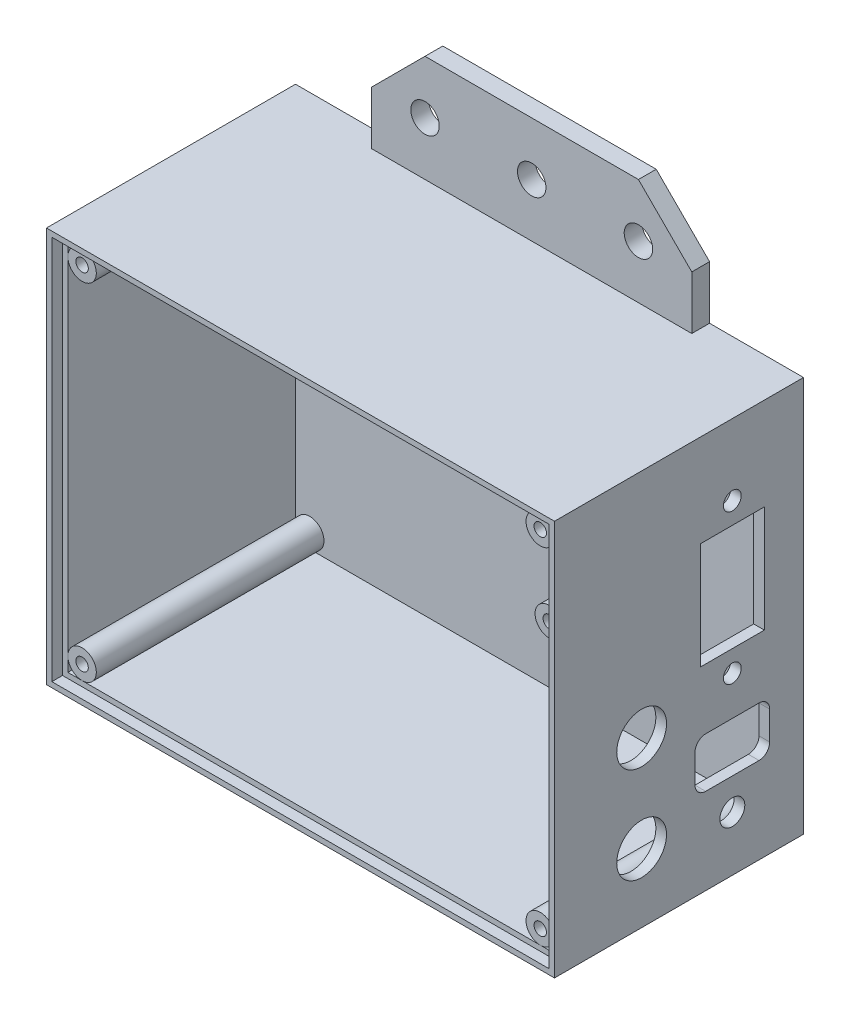
from build123d import *

# Parameters (mm, degrees)
CROQUIS2_W                = 142.8
CROQUIS2_H                = 111.2
CROQUIS2_R                = 1.75
SALIENTE_EXTRUIR1_DEPTH   = 3
CROQUIS3_R                = 4
CROQUIS3_R_2              = 1.75
SALIENTE_EXTRUIR7_DEPTH   = 70
SALIENTE_EXTRUIR7_2_DEPTH = 70
SALIENTE_EXTRUIR7_3_DEPTH = 70
SALIENTE_EXTRUIR7_4_DEPTH = 70
CROQUIS3_W                = 142.8
CROQUIS3_H                = 111.2
CROQUIS3_W_2              = 136.8
CROQUIS3_H_2              = 105.2
SALIENTE_EXTRUIR7_5_DEPTH = 70
CROQUIS4_R                = 4
CROQUIS4_R_2              = 1.75
SALIENTE_EXTRUIR8_DEPTH   = 10
CROQUIS5_R                = 4
CORTAR_EXTRUIR1_DEPTH     = 1.5
CROQUIS6_R                = 2.5
CROQUIS6_R_2              = 7
CROQUIS6_R_3              = 3.5
CROQUIS6_W                = 18
CROQUIS6_H                = 30
CORTAR_EXTRUIR2_DEPTH     = 37.5
CORTAR_EXTRUIR3_DEPTH     = 3
CROQUIS8_R                = 4
SALIENTE_EXTRUIR9_DEPTH   = 5


with BuildPart() as part:
    # Croquis2 → Saliente-Extruir1 (new body)
    with BuildSketch(Plane.XY):
        with Locations((-26.4, -20.6)):
            Rectangle(CROQUIS2_W, CROQUIS2_H)
        Circle(CROQUIS2_R, mode=Mode.SUBTRACT)
        with Locations((-50.8, -11.75)):
            Circle(CROQUIS2_R, mode=Mode.SUBTRACT)
        with Locations((-16.46, -50.2)):
            Circle(CROQUIS2_R, mode=Mode.SUBTRACT)
    extrude(amount=SALIENTE_EXTRUIR1_DEPTH)



with BuildPart() as body_2:
    # Croquis3 → Saliente-Extruir7 (new body)
    with BuildSketch(Plane.XY):
        with Locations((-90.8, -69.2)):
            Circle(CROQUIS3_R)
        with Locations((-90.8, -69.2)):
            Circle(CROQUIS3_R_2, mode=Mode.SUBTRACT)
    extrude(amount=SALIENTE_EXTRUIR7_DEPTH)


with BuildPart() as body_3:
    # Croquis3 → Saliente-Extruir7 2 (new body)
    with BuildSketch(Plane.XY):
        with Locations((38, -69.2)):
            Circle(CROQUIS3_R)
        with Locations((38, -69.2)):
            Circle(CROQUIS3_R_2, mode=Mode.SUBTRACT)
    extrude(amount=SALIENTE_EXTRUIR7_2_DEPTH)


with BuildPart() as body_4:
    # Croquis3 → Saliente-Extruir7 3 (new body)
    with BuildSketch(Plane.XY):
        with Locations((38, 28)):
            Circle(CROQUIS3_R)
        with Locations((38, 28)):
            Circle(CROQUIS3_R_2, mode=Mode.SUBTRACT)
    extrude(amount=SALIENTE_EXTRUIR7_3_DEPTH)


with BuildPart() as body_5:
    # Croquis3 → Saliente-Extruir7 4 (new body)
    with BuildSketch(Plane.XY):
        with Locations((-90.8, 28)):
            Circle(CROQUIS3_R)
        with Locations((-90.8, 28)):
            Circle(CROQUIS3_R_2, mode=Mode.SUBTRACT)
    extrude(amount=SALIENTE_EXTRUIR7_4_DEPTH)


with BuildPart() as body_6:
    # Croquis3 → Saliente-Extruir7 5 (new body)
    with BuildSketch(Plane.XY):
        with Locations((-26.4, -20.6)):
            Rectangle(CROQUIS3_W, CROQUIS3_H)
        with Locations((-26.4, -20.6)):
            Rectangle(CROQUIS3_W_2, CROQUIS3_H_2, mode=Mode.SUBTRACT)
    extrude(amount=SALIENTE_EXTRUIR7_5_DEPTH)


with BuildPart() as part_1:
    add(part.part)

    add(body_6.part)  # Saliente-Extruir8 merges body 6
    # Croquis4 → Saliente-Extruir8 (add)
    # profile 1 of 3: a face of its own
    with BuildSketch(Plane.XY):
        with Locations((-50.8, -11.75)):
            Circle(CROQUIS4_R)
        with Locations((-50.8, -11.75)):
            Circle(CROQUIS4_R_2, mode=Mode.SUBTRACT)
    # profile 2 of 3: a face of its own
    with BuildSketch(Plane.XY):
        with Locations((-16.46, -50.2)):
            Circle(CROQUIS4_R)
        with Locations((-16.46, -50.2)):
            Circle(CROQUIS4_R_2, mode=Mode.SUBTRACT)
    # profile 3 of 3: a face of its own
    with BuildSketch(Plane.XY):
        Circle(CROQUIS4_R)
        Circle(CROQUIS4_R_2, mode=Mode.SUBTRACT)
    extrude(amount=SALIENTE_EXTRUIR8_DEPTH)

    # Croquis5 → Cortar-Extruir1 (cut)
    with BuildSketch(Plane.XY):
        Circle(CROQUIS5_R)
        with Locations((-16.46, -50.2)):
            Circle(CROQUIS5_R)
        with Locations((-50.8, -11.75)):
            Circle(CROQUIS5_R)
    extrude(amount=CORTAR_EXTRUIR1_DEPTH, mode=Mode.SUBTRACT)

    # Croquis6 → Cortar-Extruir2 (cut)
    with BuildSketch(Plane(origin=(50, 0, 0), x_dir=(0, 0, -1), z_dir=(1, 0, 0))):
        with Locations((-20, 15)):
            Circle(CROQUIS6_R)
        with Locations((-20, -27)):
            Circle(CROQUIS6_R)
        with Locations((-45.5, -57)):
            Circle(CROQUIS6_R_2)
        with Locations((-45.5, -30)):
            Circle(CROQUIS6_R_2)
        with Locations((-20, -60.822661342)):
            Circle(CROQUIS6_R_3)
        with BuildLine():
            Line((-12.5, -38), (-27.5, -38))
            ThreePointArc((-27.5, -38), (-29.621320344, -38.878679656), (-30.5, -41))
            Line((-30.5, -41), (-30.5, -49))
            ThreePointArc((-30.5, -49), (-29.621320344, -51.121320344), (-27.5, -52))
            Line((-27.5, -52), (-12.5, -52))
            ThreePointArc((-12.5, -52), (-10.378679656, -51.121320344), (-9.5, -49))
            Line((-9.5, -49), (-9.5, -41))
            ThreePointArc((-9.5, -41), (-10.378679656, -38.878679656), (-12.5, -38))
        make_face()
        with Locations((-20, -6)):
            Rectangle(CROQUIS6_W, CROQUIS6_H)
    extrude(amount=-CORTAR_EXTRUIR2_DEPTH, mode=Mode.SUBTRACT)


with BuildPart() as cortar_extruir3_tool:
    # Croquis7 → Cortar-Extruir3 (new body)
    with BuildSketch(Plane.XY.offset(70)):
        Polygon((43.5, 33.5), (-94.8, 33.5), (-96.3, 33.5), (-96.3, 32), (-96.3, -74.7), (42, -74.7), (43.5, -74.7), (43.5, -73.2), align=None)
    extrude(amount=-CORTAR_EXTRUIR3_DEPTH)


with BuildPart() as part_2:
    add(part_1.part)

    # Cortar-Extruir3: cut by cortar_extruir3_tool
    add(cortar_extruir3_tool.part, mode=Mode.SUBTRACT)

    # Croquis8 → Saliente-Extruir9 (add)
    # profile 1 of 2: a face of its own
    with BuildSketch(Plane.XY):
        Polygon((-71.4, -76.2), (18.6, -76.2), (18.6, -91.2), (3.6, -106.2), (-56.4, -106.2), (-71.4, -91.2), align=None)
        with Locations((-56.4, -91.2)):
            Circle(CROQUIS8_R, mode=Mode.SUBTRACT)
        with Locations((-26.4, -91.2)):
            Circle(CROQUIS8_R, mode=Mode.SUBTRACT)
        with Locations((3.6, -91.2)):
            Circle(CROQUIS8_R, mode=Mode.SUBTRACT)
    # profile 2 of 2: a face of its own
    with BuildSketch(Plane.XY):
        Polygon((-26.4, 65), (-56.4, 65), (-71.4, 50), (-71.4, 35), (18.6, 35), (18.6, 50), (3.6, 65), align=None)
        with Locations((-56.4, 50)):
            Circle(CROQUIS8_R, mode=Mode.SUBTRACT)
        with Locations((-26.4, 50)):
            Circle(CROQUIS8_R, mode=Mode.SUBTRACT)
        with Locations((3.6, 50)):
            Circle(CROQUIS8_R, mode=Mode.SUBTRACT)
    extrude(amount=SALIENTE_EXTRUIR9_DEPTH)


with BuildPart() as body_2_1:
    add(body_2.part)

    # Cortar-Extruir3: cut by cortar_extruir3_tool
    add(cortar_extruir3_tool.part, mode=Mode.SUBTRACT)


with BuildPart() as body_3_1:
    add(body_3.part)

    # Cortar-Extruir3: cut by cortar_extruir3_tool
    add(cortar_extruir3_tool.part, mode=Mode.SUBTRACT)


with BuildPart() as body_4_1:
    add(body_4.part)

    # Cortar-Extruir3: cut by cortar_extruir3_tool
    add(cortar_extruir3_tool.part, mode=Mode.SUBTRACT)


with BuildPart() as body_5_1:
    add(body_5.part)

    # Cortar-Extruir3: cut by cortar_extruir3_tool
    add(cortar_extruir3_tool.part, mode=Mode.SUBTRACT)


solid = Compound([part_2.part, body_2_1.part, body_3_1.part, body_4_1.part, body_5_1.part])
